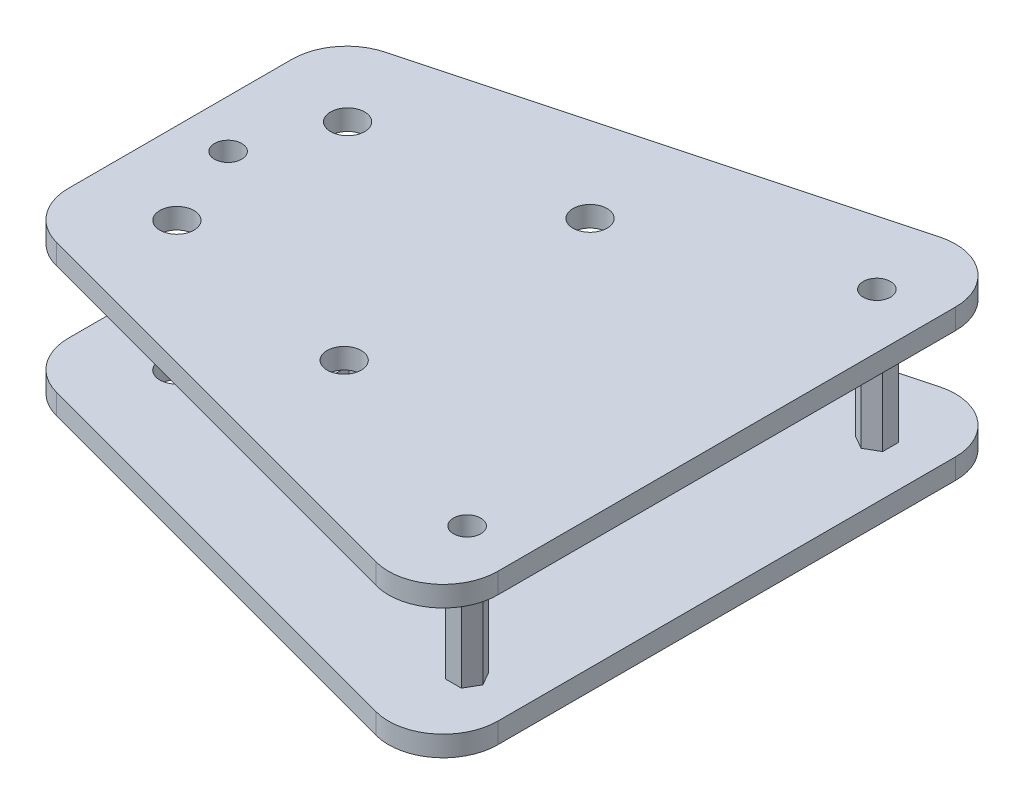
from build123d import *

# Parameters (mm, degrees)
CROQUIS1_R                = 2.5
CROQUIS1_R_2              = 2
SALIENTE_EXTRUIR1_DEPTH   = 22
CROQUIS2_W                = 80
CROQUIS2_H                = 16
CORTAR_EXTRUIR1_DEPTH     = 50
SALIENTE_EXTRUIR2_DEPTH   = 16
SALIENTE_EXTRUIR2_2_DEPTH = 16
SALIENTE_EXTRUIR2_3_DEPTH = 16
CUT_EXTRUDE1_DEPTH        = 11


with BuildPart() as part:
    # Croquis1 → Saliente-Extruir1 (new body)
    with BuildSketch(Plane(origin=(0, 0, 0), x_dir=(1, 0, 0), z_dir=(0, 1, 0))):
        with BuildLine():
            Line((0, 16.361384096), (0, -16.361384096))
            ThreePointArc((0, -16.361384096), (1.653173278, -21.231475528), (5.929447639, -24.088790706))
            Line((5.929447639, -24.088790706), (69.929447639, -41.237539022))
            ThreePointArc((69.929447639, -41.237539022), (76.870091432, -39.856959134), (80, -33.510132412))
            Line((80, -33.510132412), (80, 33.510132412))
            ThreePointArc((80, 33.510132412), (76.870091432, 39.856959134), (69.929447639, 41.237539022))
            Line((69.929447639, 41.237539022), (5.929447639, 24.088790706))
            ThreePointArc((5.929447639, 24.088790706), (1.653173278, 21.231475528), (0, 16.361384096))
        make_face()
        with Locations(Location((12, 12.5, 0), (0, 0, 270))):
            Circle(CROQUIS1_R, mode=Mode.SUBTRACT)
        with Locations(Location((12, -12.5, 0), (0, 0, 270))):
            Circle(CROQUIS1_R, mode=Mode.SUBTRACT)
        with Locations(Location((42, 18, 0), (0, 0, 270))):
            Circle(CROQUIS1_R, mode=Mode.SUBTRACT)
        with Locations(Location((42, -18, 0), (0, 0, 270))):
            Circle(CROQUIS1_R, mode=Mode.SUBTRACT)
        with Locations(Location((7, 0, 0), (0, 0, 270))):
            Circle(CROQUIS1_R_2, mode=Mode.SUBTRACT)
        with Locations(Location((72, -30, 0), (0, 0, 270))):
            Circle(CROQUIS1_R_2, mode=Mode.SUBTRACT)
        with Locations(Location((72, 30, 0), (0, 0, 270))):
            Circle(CROQUIS1_R_2, mode=Mode.SUBTRACT)
    extrude(amount=SALIENTE_EXTRUIR1_DEPTH)

    # Croquis2 → Cortar-Extruir1 (cut, symmetric)
    with BuildSketch(Plane.XY):
        with Locations((40, 11)):
            Rectangle(CROQUIS2_W, CROQUIS2_H)
    extrude(amount=CORTAR_EXTRUIR1_DEPTH, both=True, mode=Mode.SUBTRACT)


with BuildPart() as cortar_extruir1_piece_1:
    # of the separate pieces the step leaves, piece 1, a body of its own (cortar_extruir1_pieces)
    add(part.part.solids().sort_by_distance((69.929447639, 0, -41.237539022))[0])

    # Sketch1 → Cut-Extrude1 (cut)
    # profile 1 of 7: a face of its own
    with BuildSketch(Plane(origin=(0, 0, 0), x_dir=(-1, 0, 0), z_dir=(0, -1, 0))):
        with BuildLine():
            Line((-60.773891073, 3.225698816), (-57.023891073, 3.225698816))
            Line((-57.023891073, 3.225698816), (-57.023891073, 2.744929585))
            Line((-57.023891073, 2.744929585), (-57.524191554, 2.744929585))
            add(Edge.make_bspline(
                [(-57.524191554, 2.744929585), (-57.565268647, 2.744001604), (-57.640621666, 2.742299287), (-57.744355067, 2.731956929), (-57.827880549, 2.70965445), (-57.893239168, 2.680273801), (-57.940778851, 2.642177532), (-57.975266029, 2.59954546), (-57.995941385, 2.549820501), (-57.997941334, 2.5147441), (-57.998951169, 2.497032951)],
                knots=[0, 0, 0, 0, 1.649978988, 3.026769637, 4.173115814, 5.108527378, 5.881060813, 6.597094959, 7.291630266, 8, 8, 8, 8], degree=3))
            add(Edge.make_bspline(
                [(-57.998951169, 2.497032951), (-57.997532175, 2.475422139), (-57.994527122, 2.429656185), (-57.977418183, 2.35920865), (-57.947884084, 2.284341099), (-57.921377291, 2.234847908), (-57.907304534, 2.208571412)],
                knots=[0, 0, 0, 0, 0.848893184, 1.797730134, 2.830789942, 4, 4, 4, 4], degree=3))
            Line((-57.907304534, 2.208571412), (-56.256162707, -0.570875703))
            Line((-56.256162707, -0.570875703), (-55.144383861, 1.691744489))
            add(Edge.make_bspline(
                [(-55.144383861, 1.691744489), (-55.123521204, 1.736974213), (-55.083610356, 1.82349994), (-55.039258675, 1.953557341), (-55.012229905, 2.077748632), (-55.008138688, 2.158873031), (-55.006162707, 2.198054585)],
                knots=[0, 0, 0, 0, 1.129148263, 2.160092213, 3.111359234, 4, 4, 4, 4], degree=3))
            add(Edge.make_bspline(
                [(-55.006162707, 2.198054585), (-55.008148023, 2.238443497), (-55.011992072, 2.316646161), (-55.05135179, 2.427058008), (-55.11661168, 2.522497226), (-55.206280573, 2.603307958), (-55.320492044, 2.669103789), (-55.460566749, 2.714193315), (-55.625652801, 2.740700372), (-55.743731872, 2.743454955), (-55.806943957, 2.744929585)],
                knots=[0, 0, 0, 0, 0.884200254, 1.7120247, 2.535601234, 3.399669589, 4.34091696, 5.408595814, 6.612725681, 8, 8, 8, 8], degree=3))
            Line((-55.806943957, 2.744929585), (-56.062352611, 2.744929585))
            Line((-56.062352611, 2.744929585), (-56.062352611, 3.225698816))
            Line((-56.062352611, 3.225698816), (-53.177737227, 3.225698816))
            Line((-53.177737227, 3.225698816), (-53.177737227, 2.744929585))
            add(Edge.make_bspline(
                [(-53.177737227, 2.744929585), (-53.257068608, 2.741372351), (-53.40821543, 2.734594898), (-53.622370649, 2.694285009), (-53.813865219, 2.636459034), (-53.9824556, 2.549956249), (-54.131071522, 2.436942797), (-54.266839958, 2.29739683), (-54.389716465, 2.128376148), (-54.458280114, 2.00113295), (-54.493842996, 1.935133912)],
                knots=[0, 0, 0, 0, 1.158631572, 2.207493144, 3.17456629, 4.071024185, 4.959115416, 5.890271789, 6.905717302, 8, 8, 8, 8], degree=3))
            Line((-54.493842996, 1.935133912), (-56.062352611, -1.032113684))
            Line((-56.062352611, -1.032113684), (-56.062352611, -3.383375703))
            add(Edge.make_bspline(
                [(-56.062352611, -3.383375703), (-56.061038261, -3.416066856), (-56.058579684, -3.477217763), (-56.037055659, -3.563177553), (-56.001536672, -3.63621342), (-55.94993174, -3.696054134), (-55.881848542, -3.741041513), (-55.797953459, -3.771220632), (-55.698697104, -3.791247038), (-55.62727091, -3.792736092), (-55.5890954, -3.793531953)],
                knots=[0, 0, 0, 0, 1.088641102, 2.036373277, 2.932535239, 3.772977452, 4.639074189, 5.622189685, 6.729120018, 8, 8, 8, 8], degree=3))
            Line((-55.5890954, -3.793531953), (-54.812352611, -3.793531953))
            Line((-54.812352611, -3.793531953), (-54.812352611, -4.274301184))
            Line((-54.812352611, -4.274301184), (-58.85081415, -4.274301184))
            Line((-58.85081415, -4.274301184), (-58.85081415, -3.793531953))
            Line((-58.85081415, -3.793531953), (-58.078578573, -3.793531953))
            add(Edge.make_bspline(
                [(-58.078578573, -3.793531953), (-58.037969675, -3.792467689), (-57.962291503, -3.790484341), (-57.857770647, -3.77413497), (-57.7732193, -3.742384569), (-57.705176728, -3.699580135), (-57.657432145, -3.639050817), (-57.62437071, -3.565809993), (-57.602853298, -3.479227667), (-57.601520305, -3.416569164), (-57.60081415, -3.383375703)],
                knots=[0, 0, 0, 0, 1.33431287, 2.486606761, 3.455237023, 4.285744345, 5.09261012, 5.946421484, 6.912112891, 8, 8, 8, 8], degree=3))
            Line((-57.60081415, -3.383375703), (-57.60081415, -1.293531953))
            Line((-57.60081415, -1.293531953), (-59.657605015, 2.168006508))
            add(Edge.make_bspline(
                [(-59.657605015, 2.168006508), (-59.688999915, 2.219874353), (-59.748649641, 2.318422293), (-59.851040792, 2.446137845), (-59.954646645, 2.549436821), (-60.064994796, 2.626569597), (-60.184672816, 2.678808855), (-60.313871258, 2.71915544), (-60.457661124, 2.74086375), (-60.557980287, 2.743538943), (-60.610129054, 2.744929585)],
                knots=[0, 0, 0, 0, 1.231026377, 2.338927208, 3.317810476, 4.195831411, 5.056695332, 5.961387997, 6.940271265, 8, 8, 8, 8], degree=3))
            Line((-60.610129054, 2.744929585), (-60.773891073, 2.744929585))
            Line((-60.773891073, 2.744929585), (-60.773891073, 3.225698816))
        make_face()
    # profile 2 of 7: a face of its own
    with BuildSketch(Plane(origin=(0, 0, 0), x_dir=(-1, 0, 0), z_dir=(0, -1, 0))):
        with BuildLine():
            Line((-47.253758861, -3.793531953), (-47.023891073, -4.125563203))
            add(Edge.make_bspline(
                [(-47.023891073, -4.125563203), (-47.076209743, -4.155581503), (-47.177095033, -4.21346533), (-47.326447031, -4.289157236), (-47.468932454, -4.34777549), (-47.604453888, -4.395012571), (-47.740278518, -4.425821324), (-47.878457208, -4.450882635), (-48.023735477, -4.464033299), (-48.122626667, -4.465737053), (-48.173230015, -4.466608876)],
                knots=[0, 0, 0, 0, 1.190639995, 2.295892828, 3.301952218, 4.230417227, 5.124784651, 6.047918919, 7.001105777, 8, 8, 8, 8], degree=3))
            add(Edge.make_bspline(
                [(-48.173230015, -4.466608876), (-48.245960339, -4.464235527), (-48.384723869, -4.459707371), (-48.582825528, -4.427493656), (-48.758308673, -4.370093848), (-48.917807633, -4.290641598), (-49.059930501, -4.1740205), (-49.190731816, -4.019562539), (-49.317347612, -3.827342225), (-49.389373061, -3.680788253), (-49.427737227, -3.602726665)],
                knots=[0, 0, 0, 0, 1.066664263, 2.035108476, 2.931696402, 3.766104972, 4.633328674, 5.606912326, 6.725328147, 8, 8, 8, 8], degree=3))
            add(Edge.make_bspline(
                [(-49.427737227, -3.602726665), (-49.508304398, -3.681005182), (-49.66058918, -3.828964041), (-49.892292736, -4.020883661), (-50.110769963, -4.173390766), (-50.321135674, -4.289631377), (-50.534100151, -4.368272059), (-50.753166966, -4.426656646), (-50.986262482, -4.459236734), (-51.145891411, -4.464112578), (-51.227617034, -4.466608876)],
                knots=[0, 0, 0, 0, 1.308593802, 2.473450624, 3.50132852, 4.409978718, 5.265108425, 6.139845439, 7.047651995, 8, 8, 8, 8], degree=3))
            add(Edge.make_bspline(
                [(-51.227617034, -4.466608876), (-51.283769366, -4.466133423), (-51.393332098, -4.465205733), (-51.552112753, -4.446742931), (-51.702373709, -4.424771264), (-51.842060717, -4.387376869), (-51.974215702, -4.343595859), (-52.094971893, -4.285520445), (-52.208446539, -4.221237563), (-52.309761481, -4.14477692), (-52.399515793, -4.05995162), (-52.480417332, -3.971969256), (-52.546967557, -3.876145561), (-52.601072519, -3.774505038), (-52.645373452, -3.668190266), (-52.675090567, -3.555451497), (-52.693643908, -3.438083534), (-52.695849944, -3.35790541), (-52.696967996, -3.317269934)],
                knots=[0, 0, 0, 0, 1.285346722, 2.507929693, 3.658414148, 4.76028252, 5.816036181, 6.842461126, 7.824322881, 8.799459477, 9.741018542, 10.650872844, 11.53244219, 12.405008039, 13.284858853, 14.164260801, 15.069619819, 16, 16, 16, 16], degree=3))
            add(Edge.make_bspline(
                [(-52.696967996, -3.317269934), (-52.694414326, -3.256048008), (-52.689374067, -3.135212345), (-52.656823232, -2.958719189), (-52.598064089, -2.792317431), (-52.518300942, -2.635636596), (-52.415685032, -2.487670721), (-52.290879487, -2.349423936), (-52.141304921, -2.222270539), (-52.03019587, -2.147800268), (-51.972809342, -2.109337242)],
                knots=[0, 0, 0, 0, 0.995801517, 1.96544511, 2.905633422, 3.856346558, 4.816537031, 5.825738476, 6.877019287, 8, 8, 8, 8], degree=3))
            add(Edge.make_bspline(
                [(-51.972809342, -2.109337242), (-51.917752753, -2.07821739), (-51.796234972, -2.009531418), (-51.584113776, -1.922544554), (-51.330573982, -1.831987211), (-51.033253451, -1.743565752), (-50.693277372, -1.652985993), (-50.309856275, -1.566232553), (-49.88394476, -1.474967379), (-49.584632312, -1.419015128), (-49.427737227, -1.389685799)],
                knots=[0, 0, 0, 0, 0.571158686, 1.260629055, 2.068141078, 3.004654038, 4.063103147, 5.24787825, 6.557379157, 8, 8, 8, 8], degree=3))
            Line((-49.427737227, -1.389685799), (-49.427737227, -0.733135319))
            add(Edge.make_bspline(
                [(-49.427737227, -0.733135319), (-49.430292464, -0.670731521), (-49.435234684, -0.550033041), (-49.482794213, -0.378244207), (-49.563242276, -0.225874067), (-49.671857345, -0.093406854), (-49.806186837, 0.016884074), (-49.9661648, 0.093126616), (-50.145562532, 0.141702377), (-50.272252919, 0.146354406), (-50.338193957, 0.148775739)],
                knots=[0, 0, 0, 0, 1.048850548, 2.028637255, 2.971451416, 3.930078998, 4.895246658, 5.871835951, 6.892312576, 8, 8, 8, 8], degree=3))
            add(Edge.make_bspline(
                [(-50.338193957, 0.148775739), (-50.389931654, 0.147227632), (-50.490648185, 0.144213969), (-50.636186491, 0.115424194), (-50.773995185, 0.073684815), (-50.857153212, 0.02854193), (-50.898590592, 0.006047374)],
                knots=[0, 0, 0, 0, 1.060051457, 2.0635767, 3.035086446, 4, 4, 4, 4], degree=3))
            add(Edge.make_bspline(
                [(-50.898590592, 0.006047374), (-50.923324609, -0.008569585), (-50.968269324, -0.035130375), (-51.019845099, -0.083317049), (-51.055130141, -0.131770558), (-51.060042334, -0.166786837), (-51.062352611, -0.183255511)],
                knots=[0, 0, 0, 0, 1.317511825, 2.394079104, 3.244711643, 4, 4, 4, 4], degree=3))
            add(Edge.make_bspline(
                [(-51.062352611, -0.183255511), (-51.058347481, -0.204175816), (-51.048184547, -0.257260642), (-51.018649547, -0.30286129), (-51.000754054, -0.330491088)],
                knots=[0, 0, 0, 0, 0.788183978, 2, 2, 2, 2], degree=3))
            add(Edge.make_bspline(
                [(-51.000754054, -0.330491088), (-50.980654043, -0.367068227), (-50.94152073, -0.438281355), (-50.902068199, -0.550471802), (-50.873770605, -0.660618965), (-50.871271072, -0.734468386), (-50.870044919, -0.770695415)],
                knots=[0, 0, 0, 0, 1.07655196, 2.095971236, 3.065973652, 4, 4, 4, 4], degree=3))
            add(Edge.make_bspline(
                [(-50.870044919, -0.770695415), (-50.872302961, -0.814995261), (-50.876663602, -0.900545363), (-50.912009258, -1.023159682), (-50.973249413, -1.131169463), (-51.056978356, -1.223879847), (-51.160779106, -1.297843269), (-51.281353862, -1.352879808), (-51.418863386, -1.384175746), (-51.515418829, -1.387800034), (-51.5656579, -1.389685799)],
                knots=[0, 0, 0, 0, 1.013390106, 1.957018698, 2.891613793, 3.833568295, 4.79480406, 5.790452495, 6.850343284, 8, 8, 8, 8], degree=3))
            add(Edge.make_bspline(
                [(-51.5656579, -1.389685799), (-51.61947663, -1.38761974), (-51.72292886, -1.38364829), (-51.869090939, -1.346726988), (-51.999557147, -1.28748239), (-52.110311162, -1.203263852), (-52.199722792, -1.100054765), (-52.266750474, -0.98211924), (-52.30426621, -0.848531995), (-52.309610159, -0.755392538), (-52.312352611, -0.707594453)],
                knots=[0, 0, 0, 0, 1.135686363, 2.183055715, 3.163294458, 4.145531186, 5.098416576, 6.031881768, 6.989984632, 8, 8, 8, 8], degree=3))
            add(Edge.make_bspline(
                [(-52.312352611, -0.707594453), (-52.311218457, -0.666875328), (-52.30896864, -0.586100946), (-52.281318516, -0.467591336), (-52.240546562, -0.352701244), (-52.185147473, -0.240071755), (-52.109633886, -0.133687125), (-52.020977516, -0.029219249), (-51.914631513, 0.070390703), (-51.835159078, 0.130950808), (-51.794023284, 0.162297374)],
                knots=[0, 0, 0, 0, 0.92632937, 1.837556265, 2.758171635, 3.702539709, 4.687229428, 5.723494537, 6.821656112, 8, 8, 8, 8], degree=3))
            add(Edge.make_bspline(
                [(-51.794023284, 0.162297374), (-51.739134716, 0.200001777), (-51.628981027, 0.275669249), (-51.45019452, 0.368851913), (-51.263780162, 0.451676075), (-51.065877275, 0.515054392), (-50.859120237, 0.566400604), (-50.642374288, 0.604485753), (-50.415212881, 0.624865214), (-50.260607016, 0.62796686), (-50.181943957, 0.62954497)],
                knots=[0, 0, 0, 0, 0.935767956, 1.877955579, 2.83059031, 3.801741558, 4.795990138, 5.825443329, 6.893591268, 8, 8, 8, 8], degree=3))
            add(Edge.make_bspline(
                [(-50.181943957, 0.62954497), (-50.06411838, 0.626585062), (-49.834701814, 0.620821865), (-49.500641993, 0.578220974), (-49.186188577, 0.508326923), (-48.989362034, 0.435416477), (-48.892881457, 0.399677181)],
                knots=[0, 0, 0, 0, 1.073185449, 2.089584671, 3.063551235, 4, 4, 4, 4], degree=3))
            add(Edge.make_bspline(
                [(-48.892881457, 0.399677181), (-48.834208211, 0.372554199), (-48.717492907, 0.318600015), (-48.560282711, 0.202391163), (-48.42103127, 0.059701117), (-48.30166734, -0.109600754), (-48.200597861, -0.300923655), (-48.131352087, -0.516436757), (-48.088074402, -0.752429352), (-48.083802362, -0.91672648), (-48.081583381, -1.002065607)],
                knots=[0, 0, 0, 0, 0.899251728, 1.788829553, 2.707149947, 3.66811373, 4.667398255, 5.711717518, 6.811421525, 8, 8, 8, 8], degree=3))
            Line((-48.081583381, -1.002065607), (-48.081583381, -3.378868492))
            add(Edge.make_bspline(
                [(-48.081583381, -3.378868492), (-48.080103201, -3.42103513), (-48.077353365, -3.499371104), (-48.058594977, -3.607993755), (-48.025804858, -3.699565572), (-47.989126961, -3.74715284), (-47.9719079, -3.769493492)],
                knots=[0, 0, 0, 0, 1.220920604, 2.268191387, 3.186973035, 4, 4, 4, 4], degree=3))
            add(Edge.make_bspline(
                [(-47.9719079, -3.769493492), (-47.952670447, -3.788082394), (-47.914164923, -3.825289787), (-47.841227922, -3.862409225), (-47.759059964, -3.886173227), (-47.700661424, -3.888474552), (-47.669924727, -3.889685799)],
                knots=[0, 0, 0, 0, 0.954778983, 1.911077644, 2.900544867, 4, 4, 4, 4], degree=3))
            add(Edge.make_bspline(
                [(-47.669924727, -3.889685799), (-47.64130435, -3.8883536), (-47.579576596, -3.885480343), (-47.481619921, -3.865727394), (-47.371270398, -3.835389979), (-47.294653364, -3.80809872), (-47.253758861, -3.793531953)],
                knots=[0, 0, 0, 0, 0.800345766, 1.72616688, 2.78633678, 4, 4, 4, 4], degree=3))
        make_face()
        with BuildLine():
            add(Edge.make_bspline(
                [(-49.427737227, -1.87045503), (-49.508953055, -1.882433337), (-49.664798812, -1.905418615), (-49.888016701, -1.947166196), (-50.090493665, -1.995067488), (-50.272723731, -2.047107577), (-50.434389211, -2.104124875), (-50.575909664, -2.165037226), (-50.697965193, -2.230815824), (-50.799775656, -2.303772912), (-50.885687442, -2.381759906), (-50.958302285, -2.465284152), (-51.02034966, -2.553672014), (-51.070191374, -2.648923902), (-51.111860914, -2.748943069), (-51.137594262, -2.85653092), (-51.155097062, -2.969141152), (-51.157349078, -3.04626399), (-51.158506457, -3.085899742)],
                knots=[0, 0, 0, 0, 1.681975776, 3.227557921, 4.651191003, 5.943682547, 7.108803403, 8.161104256, 9.097960246, 9.943676724, 10.720883199, 11.469943612, 12.207173587, 12.927865325, 13.669083436, 14.420669724, 15.188334545, 16, 16, 16, 16], degree=3))
            add(Edge.make_bspline(
                [(-51.158506457, -3.085899742), (-51.156705584, -3.139646896), (-51.153287093, -3.24167192), (-51.1220683, -3.384972227), (-51.068672116, -3.508683362), (-50.994869803, -3.612924365), (-50.899353171, -3.694023397), (-50.78682726, -3.751980799), (-50.657772238, -3.787189837), (-50.566290448, -3.791355168), (-50.518482419, -3.793531953)],
                knots=[0, 0, 0, 0, 1.189819512, 2.258563569, 3.227487892, 4.157509628, 5.062572389, 5.97576097, 6.942140511, 8, 8, 8, 8], degree=3))
            add(Edge.make_bspline(
                [(-50.518482419, -3.793531953), (-50.479877215, -3.792167899), (-50.404380211, -3.789500331), (-50.293433043, -3.774705846), (-50.187812206, -3.747990839), (-50.088319036, -3.707747873), (-49.992781942, -3.659820913), (-49.901824319, -3.600721045), (-49.816294208, -3.529999451), (-49.737046572, -3.448297954), (-49.662833319, -3.359042415), (-49.599920735, -3.259283975), (-49.547307834, -3.151727227), (-49.503500431, -3.036597655), (-49.468817757, -2.913485181), (-49.445616522, -2.782097569), (-49.429715222, -2.643581399), (-49.42840692, -2.548587625), (-49.427737227, -2.499962242)],
                knots=[0, 0, 0, 0, 0.975091251, 1.906905293, 2.820957317, 3.718054817, 4.611669124, 5.516665246, 6.450964701, 7.407843816, 8.387516827, 9.376855626, 10.377925808, 11.406652237, 12.483683151, 13.602377652, 14.772705824, 16, 16, 16, 16], degree=3))
            Line((-49.427737227, -2.499962242), (-49.427737227, -1.87045503))
        make_face(mode=Mode.SUBTRACT)
    # profile 3 of 7: a face of its own
    with BuildSketch(Plane(origin=(0, 0, 0), x_dir=(-1, 0, 0), z_dir=(0, -1, 0))):
        with BuildLine():
            Line((-43.562352611, 3.225698816), (-41.062352611, 3.418006508))
            Line((-41.062352611, 3.418006508), (-41.062352611, -2.833495896))
            add(Edge.make_bspline(
                [(-41.062352611, -2.833495896), (-41.061508726, -2.906625149), (-41.059964077, -3.040481026), (-41.048902399, -3.221691162), (-41.030526787, -3.364474716), (-41.005108778, -3.473684857), (-40.965591851, -3.555702342), (-40.921011527, -3.623153968), (-40.865440428, -3.677361175), (-40.801008302, -3.725394987), (-40.712670005, -3.756243974), (-40.599750063, -3.779410204), (-40.456108164, -3.791348867), (-40.350724287, -3.792760409), (-40.293121842, -3.793531953)],
                knots=[0, 0, 0, 0, 1.771249853, 3.242097946, 4.393102828, 5.25803248, 5.941698374, 6.587632784, 7.205155312, 7.814282309, 8.517048691, 9.447215625, 10.604657339, 12, 12, 12, 12], degree=3))
            Line((-40.293121842, -3.793531953), (-40.293121842, -4.274301184))
            Line((-40.293121842, -4.274301184), (-42.216198765, -4.334397338))
            Line((-42.216198765, -4.334397338), (-42.408506457, -3.539625703))
            add(Edge.make_bspline(
                [(-42.408506457, -3.539625703), (-42.445258908, -3.584456433), (-42.51642329, -3.671262921), (-42.62471089, -3.793007907), (-42.730265141, -3.903458411), (-42.833385864, -4.002386145), (-42.934014961, -4.0898481), (-43.031652655, -4.165391199), (-43.127020908, -4.229193253), (-43.252044596, -4.300122422), (-43.419404836, -4.369242816), (-43.638377679, -4.425431373), (-43.879266369, -4.46003622), (-44.047507186, -4.464364126), (-44.134768477, -4.466608876)],
                knots=[0, 0, 0, 0, 1.019123134, 1.97334506, 2.863856434, 3.704571555, 4.484833956, 5.206886871, 5.873561384, 6.500440825, 7.731769516, 9.04307432, 10.466334425, 12, 12, 12, 12], degree=3))
            add(Edge.make_bspline(
                [(-44.134768477, -4.466608876), (-44.214483073, -4.464511691), (-44.370985279, -4.460394325), (-44.60010945, -4.430329171), (-44.817785988, -4.378693459), (-45.024767627, -4.30865821), (-45.220079121, -4.215981114), (-45.403883594, -4.103022784), (-45.57593235, -3.969359252), (-45.736875716, -3.818652352), (-45.880622128, -3.648226184), (-46.00816218, -3.463352357), (-46.112625429, -3.261655404), (-46.200752068, -3.047289052), (-46.268264533, -2.817631913), (-46.315097163, -2.573575023), (-46.346870946, -2.31549828), (-46.349477774, -2.138484067), (-46.35081415, -2.047738684)],
                knots=[0, 0, 0, 0, 1.035088772, 2.032170809, 2.994453607, 3.936434391, 4.864481922, 5.795873368, 6.732495421, 7.689444774, 8.653769356, 9.622470292, 10.5999517, 11.597542668, 12.628516414, 13.702472802, 14.822185049, 16, 16, 16, 16], degree=3))
            add(Edge.make_bspline(
                [(-46.35081415, -2.047738684), (-46.348798816, -1.947499161), (-46.34486953, -1.752062687), (-46.314184154, -1.466781455), (-46.265174517, -1.197415098), (-46.196706726, -0.943513385), (-46.105728788, -0.706356894), (-45.996232575, -0.484598804), (-45.866562041, -0.27891786), (-45.717299571, -0.091686037), (-45.555132743, 0.077847824), (-45.379154031, 0.224603047), (-45.194366875, 0.349318972), (-45.000762734, 0.453574197), (-44.795785626, 0.531120372), (-44.58213699, 0.589048156), (-44.358143781, 0.622048968), (-44.20598529, 0.62702131), (-44.128758861, 0.62954497)],
                knots=[0, 0, 0, 0, 1.233427243, 2.404806639, 3.526640168, 4.600198104, 5.636101454, 6.647681776, 7.639427867, 8.622208794, 9.589876305, 10.521849241, 11.43639751, 12.329723671, 13.221368586, 14.127361881, 15.049562369, 16, 16, 16, 16], degree=3))
            add(Edge.make_bspline(
                [(-44.128758861, 0.62954497), (-44.04646924, 0.626472746), (-43.885293611, 0.620455369), (-43.649679808, 0.578618403), (-43.429355237, 0.503841209), (-43.221129889, 0.401800332), (-43.023770815, 0.267441941), (-42.839603168, 0.094879503), (-42.661933846, -0.110663216), (-42.558497693, -0.267097563), (-42.504660304, -0.348519934)],
                knots=[0, 0, 0, 0, 0.992219846, 1.943400107, 2.873411088, 3.788957687, 4.731974812, 5.740634663, 6.824024997, 8, 8, 8, 8], degree=3))
            Line((-42.504660304, -0.348519934), (-42.504660304, 1.873535354))
            add(Edge.make_bspline(
                [(-42.504660304, 1.873535354), (-42.505441539, 1.935151751), (-42.506885603, 2.049045733), (-42.519082254, 2.206002679), (-42.542457272, 2.334388143), (-42.573928921, 2.437674147), (-42.614371894, 2.519403297), (-42.659175845, 2.587367825), (-42.712519237, 2.640634756), (-42.775423897, 2.683593894), (-42.85935306, 2.712423369), (-42.969582687, 2.731722255), (-43.111929207, 2.742547042), (-43.217283228, 2.74408261), (-43.275393477, 2.744929585)],
                knots=[0, 0, 0, 0, 1.585915895, 2.931464457, 4.046338307, 4.93909016, 5.700024691, 6.386459051, 7.024471193, 7.628643659, 8.330161029, 9.288263681, 10.504284204, 12, 12, 12, 12], degree=3))
            Line((-43.275393477, 2.744929585), (-43.562352611, 2.744929585))
            Line((-43.562352611, 2.744929585), (-43.562352611, 3.225698816))
        make_face()
        with BuildLine():
            add(Edge.make_bspline(
                [(-43.657004054, -0.043531953), (-43.706209563, -0.044628474), (-43.802328981, -0.046770449), (-43.941039836, -0.073518018), (-44.07020978, -0.114167608), (-44.190951015, -0.169731686), (-44.300569985, -0.244281006), (-44.401047701, -0.33379469), (-44.490693145, -0.440350418), (-44.540407965, -0.520611784), (-44.565958381, -0.56186128)],
                knots=[0, 0, 0, 0, 1.071115477, 2.092346891, 3.065852581, 4.018074183, 4.97777408, 5.944093316, 6.943388102, 8, 8, 8, 8], degree=3))
            add(Edge.make_bspline(
                [(-44.565958381, -0.56186128), (-44.585692062, -0.599086248), (-44.627130903, -0.677255113), (-44.677468531, -0.806643035), (-44.718917289, -0.951674518), (-44.753251442, -1.111325138), (-44.779931399, -1.286428617), (-44.799543519, -1.476934147), (-44.80914294, -1.683558789), (-44.811255922, -1.82637701), (-44.812352611, -1.900503107)],
                knots=[0, 0, 0, 0, 0.734876037, 1.543169267, 2.417216888, 3.365266492, 4.391295652, 5.50713649, 6.70614379, 8, 8, 8, 8], degree=3))
            add(Edge.make_bspline(
                [(-44.812352611, -1.900503107), (-44.812374512, -1.962113569), (-44.812417086, -2.081880236), (-44.803895716, -2.255160315), (-44.794139064, -2.41654911), (-44.779241881, -2.565933799), (-44.759474789, -2.703123249), (-44.738169121, -2.828937742), (-44.708980642, -2.941475459), (-44.668188532, -3.073411636), (-44.607047323, -3.220297275), (-44.513760566, -3.372965704), (-44.410454791, -3.505759118), (-44.288733871, -3.611268896), (-44.155612333, -3.693439456), (-44.012611384, -3.750482508), (-43.861616622, -3.786722228), (-43.757872428, -3.791235382), (-43.705080977, -3.793531953)],
                knots=[0, 0, 0, 0, 1.19641219, 2.325746232, 3.368717915, 4.336551961, 5.24028932, 6.060675424, 6.813215653, 7.49615923, 8.742683772, 9.890340957, 10.962784833, 11.996737331, 13.000983, 13.987166933, 14.975746264, 16, 16, 16, 16], degree=3))
            add(Edge.make_bspline(
                [(-43.705080977, -3.793531953), (-43.661444127, -3.791896749), (-43.576233236, -3.788703639), (-43.4514365, -3.769296492), (-43.333090757, -3.734704602), (-43.221872316, -3.684066317), (-43.115719379, -3.62283622), (-43.017073846, -3.546276654), (-42.924943063, -3.456239635), (-42.871454281, -3.387066549), (-42.844203573, -3.351825223)],
                knots=[0, 0, 0, 0, 1.040411318, 2.031640116, 3.002527892, 3.96988569, 4.938421576, 5.917496474, 6.939035529, 8, 8, 8, 8], degree=3))
            add(Edge.make_bspline(
                [(-42.844203573, -3.351825223), (-42.809199591, -3.302358132), (-42.739080502, -3.203266908), (-42.650454445, -3.042485228), (-42.575232774, -2.872031307), (-42.513035349, -2.6912594), (-42.467864978, -2.499747521), (-42.432171504, -2.299269033), (-42.413478457, -2.088155263), (-42.410188503, -1.944103791), (-42.408506457, -1.87045503)],
                knots=[0, 0, 0, 0, 0.924882054, 1.852700299, 2.797758513, 3.767620169, 4.767445866, 5.799740364, 6.875079902, 8, 8, 8, 8], degree=3))
            add(Edge.make_bspline(
                [(-42.408506457, -1.87045503), (-42.409521211, -1.802292154), (-42.411494801, -1.669722527), (-42.430839762, -1.47619353), (-42.457430139, -1.292906844), (-42.500865515, -1.121112763), (-42.552184873, -0.958935985), (-42.619317757, -0.808774771), (-42.695580531, -0.667826472), (-42.783986581, -0.539538723), (-42.879846279, -0.424679007), (-42.979020161, -0.322654116), (-43.083072665, -0.236951021), (-43.190038831, -0.164964), (-43.301819438, -0.110294261), (-43.41740798, -0.073388035), (-43.535643026, -0.04717994), (-43.616294536, -0.044755639), (-43.657004054, -0.043531953)],
                knots=[0, 0, 0, 0, 1.335904166, 2.598193131, 3.810499392, 4.963085132, 6.068449562, 7.141148964, 8.18256652, 9.206574162, 10.189658606, 11.11307494, 11.991824036, 12.827845903, 13.635837991, 14.421385665, 15.203181339, 16, 16, 16, 16], degree=3))
        make_face(mode=Mode.SUBTRACT)
    # profile 4 of 7: a face of its own
    with BuildSketch(Plane(origin=(0, 0, 0), x_dir=(-1, 0, 0), z_dir=(0, -1, 0))):
        with BuildLine():
            Line((-39.523891073, 3.225698816), (-37.312352611, 3.418006508))
            Line((-37.312352611, 3.418006508), (-37.312352611, -1.888483876))
            Line((-37.312352611, -1.888483876), (-35.919624246, -0.755671376))
            add(Edge.make_bspline(
                [(-35.919624246, -0.755671376), (-35.869755849, -0.713324319), (-35.779743701, -0.636888142), (-35.675933693, -0.518338568), (-35.604397714, -0.41351809), (-35.592712593, -0.342204453), (-35.587592996, -0.310959838)],
                knots=[0, 0, 0, 0, 1.378693414, 2.488533117, 3.337781633, 4, 4, 4, 4], degree=3))
            add(Edge.make_bspline(
                [(-35.587592996, -0.310959838), (-35.58959995, -0.293695579), (-35.593764767, -0.257868909), (-35.620754338, -0.206023009), (-35.669651055, -0.163218356), (-35.731524447, -0.119974607), (-35.813908041, -0.084336776), (-35.917355575, -0.059454683), (-36.04143214, -0.045402497), (-36.131425756, -0.044183618), (-36.179540111, -0.043531953)],
                knots=[0, 0, 0, 0, 0.586562145, 1.217229734, 1.926113921, 2.76961252, 3.773564686, 4.947918537, 6.368229449, 8, 8, 8, 8], degree=3))
            Line((-36.179540111, -0.043531953), (-36.35081415, -0.043531953))
            Line((-36.35081415, -0.043531953), (-36.35081415, 0.437237277))
            Line((-36.35081415, 0.437237277), (-33.562352611, 0.437237277))
            Line((-33.562352611, 0.437237277), (-33.562352611, -0.043531953))
            add(Edge.make_bspline(
                [(-33.562352611, -0.043531953), (-33.631541664, -0.046037739), (-33.762717705, -0.050788476), (-33.946622536, -0.07270558), (-34.107973201, -0.099024593), (-34.205093844, -0.127765092), (-34.250453573, -0.141188203)],
                knots=[0, 0, 0, 0, 1.19110104, 2.258217353, 3.186508793, 4, 4, 4, 4], degree=3))
            add(Edge.make_bspline(
                [(-34.250453573, -0.141188203), (-34.307033595, -0.162079079), (-34.420600506, -0.204011055), (-34.584127408, -0.28872611), (-34.743322359, -0.389018366), (-34.844007737, -0.466860702), (-34.894984823, -0.506272338)],
                knots=[0, 0, 0, 0, 0.971345689, 1.94967632, 2.961919508, 4, 4, 4, 4], degree=3))
            Line((-34.894984823, -0.506272338), (-35.698770881, -1.161320415))
            Line((-35.698770881, -1.161320415), (-33.942460784, -3.529108876))
            add(Edge.make_bspline(
                [(-33.942460784, -3.529108876), (-33.906458737, -3.569362356), (-33.837663798, -3.646281197), (-33.712122008, -3.73165041), (-33.575360794, -3.784210883), (-33.479668717, -3.790417182), (-33.431643477, -3.793531953)],
                knots=[0, 0, 0, 0, 1.085880666, 2.074967979, 3.03387901, 4, 4, 4, 4], degree=3))
            Line((-33.431643477, -3.793531953), (-33.177737227, -3.793531953))
            Line((-33.177737227, -3.793531953), (-33.177737227, -4.274301184))
            Line((-33.177737227, -4.274301184), (-36.158506457, -4.274301184))
            Line((-36.158506457, -4.274301184), (-36.158506457, -3.793531953))
            Line((-36.158506457, -3.793531953), (-35.88206415, -3.793531953))
            add(Edge.make_bspline(
                [(-35.88206415, -3.793531953), (-35.850998218, -3.792747045), (-35.7943129, -3.791314841), (-35.716439348, -3.786359654), (-35.652868071, -3.775079295), (-35.594331515, -3.75453588), (-35.538237242, -3.727002029), (-35.525134018, -3.687399795), (-35.519984823, -3.671837242)],
                knots=[0, 0, 0, 0, 1.375163053, 2.509229562, 3.457047141, 4.207182103, 5.295473472, 6, 6, 6, 6], degree=3))
            add(Edge.make_bspline(
                [(-35.519984823, -3.671837242), (-35.52285143, -3.654811444), (-35.52967506, -3.614283484), (-35.555873866, -3.582243912), (-35.571066554, -3.563664165)],
                knots=[0, 0, 0, 0, 0.840200059, 2, 2, 2, 2], degree=3))
            Line((-35.571066554, -3.563664165), (-36.727917515, -1.999661761))
            Line((-36.727917515, -1.999661761), (-37.312352611, -2.47592378))
            Line((-37.312352611, -2.47592378), (-37.312352611, -3.39389253))
            add(Edge.make_bspline(
                [(-37.312352611, -3.39389253), (-37.311354636, -3.427515628), (-37.309505112, -3.489828508), (-37.292335339, -3.576466624), (-37.260309601, -3.64691036), (-37.217023545, -3.705005057), (-37.156625064, -3.746249376), (-37.082604882, -3.774540966), (-36.99349473, -3.790367934), (-36.92930449, -3.792423377), (-36.894684342, -3.793531953)],
                knots=[0, 0, 0, 0, 1.201365978, 2.226462719, 3.131555905, 3.947874329, 4.782242627, 5.706252343, 6.762897878, 8, 8, 8, 8], degree=3))
            Line((-36.894684342, -3.793531953), (-36.543121842, -3.793531953))
            Line((-36.543121842, -3.793531953), (-36.543121842, -4.274301184))
            Line((-36.543121842, -4.274301184), (-39.427737227, -4.274301184))
            Line((-39.427737227, -4.274301184), (-39.427737227, -3.793531953))
            Line((-39.427737227, -3.793531953), (-39.1047204, -3.793531953))
            add(Edge.make_bspline(
                [(-39.1047204, -3.793531953), (-39.068563541, -3.792220291), (-39.000450318, -3.789749349), (-38.90515919, -3.768199155), (-38.826507993, -3.727947546), (-38.76159037, -3.674021348), (-38.714277646, -3.601587162), (-38.682127612, -3.513739956), (-38.660527934, -3.410945885), (-38.659206194, -3.336925483), (-38.658506457, -3.297738684)],
                knots=[0, 0, 0, 0, 1.129447167, 2.127681692, 3.023514497, 3.86711445, 4.735179937, 5.691311679, 6.777767975, 8, 8, 8, 8], degree=3))
            Line((-38.658506457, -3.297738684), (-38.658506457, 2.354304585))
            add(Edge.make_bspline(
                [(-38.658506457, 2.354304585), (-38.659922927, 2.384471081), (-38.662606327, 2.44161931), (-38.683323049, 2.522044301), (-38.720635149, 2.590113598), (-38.771005938, 2.646611665), (-38.834631904, 2.691517066), (-38.910786372, 2.722081965), (-38.998485904, 2.74261742), (-39.061016562, 2.744127917), (-39.094203573, 2.744929585)],
                knots=[0, 0, 0, 0, 1.087785527, 2.060730481, 2.966252653, 3.861989026, 4.769311801, 5.74911033, 6.805381193, 8, 8, 8, 8], degree=3))
            Line((-39.094203573, 2.744929585), (-39.523891073, 2.744929585))
            Line((-39.523891073, 2.744929585), (-39.523891073, 3.225698816))
        make_face()
    # profile 5 of 7: a face of its own
    with BuildSketch(Plane(origin=(0, 0, 0), x_dir=(-1, 0, 0), z_dir=(0, -1, 0))):
        with BuildLine():
            Line((-27.061451169, -3.793531953), (-26.831583381, -4.125563203))
            add(Edge.make_bspline(
                [(-26.831583381, -4.125563203), (-26.883902051, -4.155581503), (-26.984787341, -4.21346533), (-27.134139338, -4.289157236), (-27.276624762, -4.34777549), (-27.412146196, -4.395012571), (-27.547970825, -4.425821324), (-27.686149516, -4.450882635), (-27.831427785, -4.464033299), (-27.930318975, -4.465737053), (-27.980922323, -4.466608876)],
                knots=[0, 0, 0, 0, 1.190639995, 2.295892828, 3.301952218, 4.230417227, 5.124784651, 6.047918919, 7.001105777, 8, 8, 8, 8], degree=3))
            add(Edge.make_bspline(
                [(-27.980922323, -4.466608876), (-28.053652647, -4.464235527), (-28.192416176, -4.459707371), (-28.390517835, -4.427493656), (-28.566000981, -4.370093848), (-28.725499941, -4.290641598), (-28.867622808, -4.1740205), (-28.998424124, -4.019562539), (-29.125039919, -3.827342225), (-29.197065368, -3.680788253), (-29.235429534, -3.602726665)],
                knots=[0, 0, 0, 0, 1.066664263, 2.035108476, 2.931696402, 3.766104972, 4.633328674, 5.606912326, 6.725328147, 8, 8, 8, 8], degree=3))
            add(Edge.make_bspline(
                [(-29.235429534, -3.602726665), (-29.315996706, -3.681005182), (-29.468281488, -3.828964041), (-29.699985043, -4.020883661), (-29.91846227, -4.173390766), (-30.128827982, -4.289631377), (-30.341792458, -4.368272059), (-30.560859273, -4.426656646), (-30.79395479, -4.459236734), (-30.953583718, -4.464112578), (-31.035309342, -4.466608876)],
                knots=[0, 0, 0, 0, 1.308593802, 2.473450624, 3.50132852, 4.409978718, 5.265108425, 6.139845439, 7.047651995, 8, 8, 8, 8], degree=3))
            add(Edge.make_bspline(
                [(-31.035309342, -4.466608876), (-31.091461673, -4.466133423), (-31.201024406, -4.465205733), (-31.359805061, -4.446742931), (-31.510066016, -4.424771264), (-31.649753024, -4.387376869), (-31.781908009, -4.343595859), (-31.9026642, -4.285520445), (-32.016138847, -4.221237563), (-32.117453789, -4.14477692), (-32.207208101, -4.05995162), (-32.28810964, -3.971969256), (-32.354659865, -3.876145561), (-32.408764826, -3.774505038), (-32.453065759, -3.668190266), (-32.482782875, -3.555451497), (-32.501336215, -3.438083534), (-32.503542251, -3.35790541), (-32.504660304, -3.317269934)],
                knots=[0, 0, 0, 0, 1.285346722, 2.507929693, 3.658414148, 4.76028252, 5.816036181, 6.842461126, 7.824322881, 8.799459477, 9.741018542, 10.650872844, 11.53244219, 12.405008039, 13.284858853, 14.164260801, 15.069619819, 16, 16, 16, 16], degree=3))
            add(Edge.make_bspline(
                [(-32.504660304, -3.317269934), (-32.502106634, -3.256048008), (-32.497066375, -3.135212345), (-32.464515539, -2.958719189), (-32.405756397, -2.792317431), (-32.325993249, -2.635636596), (-32.22337734, -2.487670721), (-32.098571795, -2.349423936), (-31.948997228, -2.222270539), (-31.837888178, -2.147800268), (-31.78050165, -2.109337242)],
                knots=[0, 0, 0, 0, 0.995801517, 1.96544511, 2.905633422, 3.856346558, 4.816537031, 5.825738476, 6.877019287, 8, 8, 8, 8], degree=3))
            add(Edge.make_bspline(
                [(-31.78050165, -2.109337242), (-31.72544506, -2.07821739), (-31.603927279, -2.009531418), (-31.391806084, -1.922544554), (-31.138266289, -1.831987211), (-30.840945759, -1.743565752), (-30.50096968, -1.652985993), (-30.117548583, -1.566232553), (-29.691637068, -1.474967379), (-29.39232462, -1.419015128), (-29.235429534, -1.389685799)],
                knots=[0, 0, 0, 0, 0.571158686, 1.260629055, 2.068141078, 3.004654038, 4.063103147, 5.24787825, 6.557379157, 8, 8, 8, 8], degree=3))
            Line((-29.235429534, -1.389685799), (-29.235429534, -0.733135319))
            add(Edge.make_bspline(
                [(-29.235429534, -0.733135319), (-29.237984772, -0.670731521), (-29.242926992, -0.550033041), (-29.290486521, -0.378244207), (-29.370934584, -0.225874067), (-29.479549653, -0.093406854), (-29.613879144, 0.016884074), (-29.773857108, 0.093126616), (-29.95325484, 0.141702377), (-30.079945226, 0.146354406), (-30.145886265, 0.148775739)],
                knots=[0, 0, 0, 0, 1.048850548, 2.028637255, 2.971451416, 3.930078998, 4.895246658, 5.871835951, 6.892312576, 8, 8, 8, 8], degree=3))
            add(Edge.make_bspline(
                [(-30.145886265, 0.148775739), (-30.197623962, 0.147227632), (-30.298340492, 0.144213969), (-30.443878798, 0.115424194), (-30.581687492, 0.073684815), (-30.66484552, 0.02854193), (-30.7062829, 0.006047374)],
                knots=[0, 0, 0, 0, 1.060051457, 2.0635767, 3.035086446, 4, 4, 4, 4], degree=3))
            add(Edge.make_bspline(
                [(-30.7062829, 0.006047374), (-30.731016917, -0.008569585), (-30.775961632, -0.035130375), (-30.827537407, -0.083317049), (-30.862822449, -0.131770558), (-30.867734642, -0.166786837), (-30.870044919, -0.183255511)],
                knots=[0, 0, 0, 0, 1.317511825, 2.394079104, 3.244711643, 4, 4, 4, 4], degree=3))
            add(Edge.make_bspline(
                [(-30.870044919, -0.183255511), (-30.866039788, -0.204175816), (-30.855876855, -0.257260642), (-30.826341855, -0.30286129), (-30.808446361, -0.330491088)],
                knots=[0, 0, 0, 0, 0.788183978, 2, 2, 2, 2], degree=3))
            add(Edge.make_bspline(
                [(-30.808446361, -0.330491088), (-30.788346351, -0.367068227), (-30.749213038, -0.438281355), (-30.709760507, -0.550471802), (-30.681462913, -0.660618965), (-30.678963379, -0.734468386), (-30.677737227, -0.770695415)],
                knots=[0, 0, 0, 0, 1.07655196, 2.095971236, 3.065973652, 4, 4, 4, 4], degree=3))
            add(Edge.make_bspline(
                [(-30.677737227, -0.770695415), (-30.679995269, -0.814995261), (-30.68435591, -0.900545363), (-30.719701566, -1.023159682), (-30.780941721, -1.131169463), (-30.864670664, -1.223879847), (-30.968471414, -1.297843269), (-31.08904617, -1.352879808), (-31.226555694, -1.384175746), (-31.323111137, -1.387800034), (-31.373350207, -1.389685799)],
                knots=[0, 0, 0, 0, 1.013390106, 1.957018698, 2.891613793, 3.833568295, 4.79480406, 5.790452495, 6.850343284, 8, 8, 8, 8], degree=3))
            add(Edge.make_bspline(
                [(-31.373350207, -1.389685799), (-31.427168938, -1.38761974), (-31.530621168, -1.38364829), (-31.676783246, -1.346726988), (-31.807249455, -1.28748239), (-31.91800347, -1.203263852), (-32.0074151, -1.100054765), (-32.074442782, -0.98211924), (-32.111958518, -0.848531995), (-32.117302467, -0.755392538), (-32.120044919, -0.707594453)],
                knots=[0, 0, 0, 0, 1.135686363, 2.183055715, 3.163294458, 4.145531186, 5.098416576, 6.031881768, 6.989984632, 8, 8, 8, 8], degree=3))
            add(Edge.make_bspline(
                [(-32.120044919, -0.707594453), (-32.118910765, -0.666875328), (-32.116660948, -0.586100946), (-32.089010823, -0.467591336), (-32.04823887, -0.352701244), (-31.99283978, -0.240071755), (-31.917326193, -0.133687125), (-31.828669824, -0.029219249), (-31.722323821, 0.070390703), (-31.642851386, 0.130950808), (-31.601715592, 0.162297374)],
                knots=[0, 0, 0, 0, 0.92632937, 1.837556265, 2.758171635, 3.702539709, 4.687229428, 5.723494537, 6.821656112, 8, 8, 8, 8], degree=3))
            add(Edge.make_bspline(
                [(-31.601715592, 0.162297374), (-31.546827024, 0.200001777), (-31.436673334, 0.275669249), (-31.257886828, 0.368851913), (-31.071472469, 0.451676075), (-30.873569582, 0.515054392), (-30.666812544, 0.566400604), (-30.450066596, 0.604485753), (-30.222905188, 0.624865214), (-30.068299324, 0.62796686), (-29.989636265, 0.62954497)],
                knots=[0, 0, 0, 0, 0.935767956, 1.877955579, 2.83059031, 3.801741558, 4.795990138, 5.825443329, 6.893591268, 8, 8, 8, 8], degree=3))
            add(Edge.make_bspline(
                [(-29.989636265, 0.62954497), (-29.871810688, 0.626585062), (-29.642394122, 0.620821865), (-29.3083343, 0.578220974), (-28.993880884, 0.508326923), (-28.797054342, 0.435416477), (-28.700573765, 0.399677181)],
                knots=[0, 0, 0, 0, 1.073185449, 2.089584671, 3.063551235, 4, 4, 4, 4], degree=3))
            add(Edge.make_bspline(
                [(-28.700573765, 0.399677181), (-28.641900518, 0.372554199), (-28.525185215, 0.318600015), (-28.367975019, 0.202391163), (-28.228723578, 0.059701117), (-28.109359648, -0.109600754), (-28.008290168, -0.300923655), (-27.939044395, -0.516436757), (-27.89576671, -0.752429352), (-27.891494669, -0.91672648), (-27.889275688, -1.002065607)],
                knots=[0, 0, 0, 0, 0.899251728, 1.788829553, 2.707149947, 3.66811373, 4.667398255, 5.711717518, 6.811421525, 8, 8, 8, 8], degree=3))
            Line((-27.889275688, -1.002065607), (-27.889275688, -3.378868492))
            add(Edge.make_bspline(
                [(-27.889275688, -3.378868492), (-27.887795508, -3.42103513), (-27.885045672, -3.499371104), (-27.866287285, -3.607993755), (-27.833497166, -3.699565572), (-27.796819269, -3.74715284), (-27.779600207, -3.769493492)],
                knots=[0, 0, 0, 0, 1.220920604, 2.268191387, 3.186973035, 4, 4, 4, 4], degree=3))
            add(Edge.make_bspline(
                [(-27.779600207, -3.769493492), (-27.760362755, -3.788082394), (-27.721857231, -3.825289787), (-27.648920229, -3.862409225), (-27.566752272, -3.886173227), (-27.508353732, -3.888474552), (-27.477617034, -3.889685799)],
                knots=[0, 0, 0, 0, 0.954778983, 1.911077644, 2.900544867, 4, 4, 4, 4], degree=3))
            add(Edge.make_bspline(
                [(-27.477617034, -3.889685799), (-27.448996657, -3.8883536), (-27.387268903, -3.885480343), (-27.289312228, -3.865727394), (-27.178962705, -3.835389979), (-27.102345672, -3.80809872), (-27.061451169, -3.793531953)],
                knots=[0, 0, 0, 0, 0.800345766, 1.72616688, 2.78633678, 4, 4, 4, 4], degree=3))
        make_face()
        with BuildLine():
            add(Edge.make_bspline(
                [(-29.235429534, -1.87045503), (-29.316645362, -1.882433337), (-29.47249112, -1.905418615), (-29.695709009, -1.947166196), (-29.898185973, -1.995067488), (-30.080416038, -2.047107577), (-30.242081519, -2.104124875), (-30.383601971, -2.165037226), (-30.5056575, -2.230815824), (-30.607467964, -2.303772912), (-30.69337975, -2.381759906), (-30.765994593, -2.465284152), (-30.828041968, -2.553672014), (-30.877883682, -2.648923902), (-30.919553222, -2.748943069), (-30.945286569, -2.85653092), (-30.96278937, -2.969141152), (-30.965041386, -3.04626399), (-30.966198765, -3.085899742)],
                knots=[0, 0, 0, 0, 1.681975776, 3.227557921, 4.651191003, 5.943682547, 7.108803403, 8.161104256, 9.097960246, 9.943676724, 10.720883199, 11.469943612, 12.207173587, 12.927865325, 13.669083436, 14.420669724, 15.188334545, 16, 16, 16, 16], degree=3))
            add(Edge.make_bspline(
                [(-30.966198765, -3.085899742), (-30.964397892, -3.139646896), (-30.9609794, -3.24167192), (-30.929760608, -3.384972227), (-30.876364424, -3.508683362), (-30.80256211, -3.612924365), (-30.707045479, -3.694023397), (-30.594519568, -3.751980799), (-30.465464546, -3.787189837), (-30.373982756, -3.791355168), (-30.326174727, -3.793531953)],
                knots=[0, 0, 0, 0, 1.189819512, 2.258563569, 3.227487892, 4.157509628, 5.062572389, 5.97576097, 6.942140511, 8, 8, 8, 8], degree=3))
            add(Edge.make_bspline(
                [(-30.326174727, -3.793531953), (-30.287569523, -3.792167899), (-30.212072519, -3.789500331), (-30.101125351, -3.774705846), (-29.995504514, -3.747990839), (-29.896011344, -3.707747873), (-29.80047425, -3.659820913), (-29.709516627, -3.600721045), (-29.623986516, -3.529999451), (-29.54473888, -3.448297954), (-29.470525627, -3.359042415), (-29.407613043, -3.259283975), (-29.355000142, -3.151727227), (-29.311192739, -3.036597655), (-29.276510065, -2.913485181), (-29.25330883, -2.782097569), (-29.237407529, -2.643581399), (-29.236099228, -2.548587625), (-29.235429534, -2.499962242)],
                knots=[0, 0, 0, 0, 0.975091251, 1.906905293, 2.820957317, 3.718054817, 4.611669124, 5.516665246, 6.450964701, 7.407843816, 8.387516827, 9.376855626, 10.377925808, 11.406652237, 12.483683151, 13.602377652, 14.772705824, 16, 16, 16, 16], degree=3))
            Line((-29.235429534, -2.499962242), (-29.235429534, -1.87045503))
        make_face(mode=Mode.SUBTRACT)
    # profile 6 of 7: a face of its own
    with BuildSketch(Plane(origin=(0, 0, 0), x_dir=(-1, 0, 0), z_dir=(0, -1, 0))):
        with BuildLine():
            add(Edge.make_bspline(
                [(-24.713193957, 3.225698816), (-24.662224381, 3.223022697), (-24.562180939, 3.217769992), (-24.419154199, 3.169564769), (-24.286438449, 3.09476659), (-24.170797209, 2.989328757), (-24.0705932, 2.866398247), (-23.999507148, 2.724833352), (-23.95342822, 2.57100767), (-23.949149932, 2.463314754), (-23.946967996, 2.408391124)],
                knots=[0, 0, 0, 0, 0.981152361, 1.925812752, 2.882661545, 3.903034282, 4.92815849, 5.926869906, 6.942698962, 8, 8, 8, 8], degree=3))
            add(Edge.make_bspline(
                [(-23.946967996, 2.408391124), (-23.949158415, 2.353474767), (-23.953453334, 2.245796115), (-23.99941194, 2.091867247), (-24.071126372, 1.950335929), (-24.169753648, 1.825948376), (-24.287032656, 1.722174067), (-24.419076305, 1.647135055), (-24.562201184, 1.599033678), (-24.662231214, 1.593766781), (-24.713193957, 1.591083431)],
                knots=[0, 0, 0, 0, 1.057142633, 2.072819497, 3.071381286, 4.103934802, 5.117770336, 6.074475774, 7.018994636, 8, 8, 8, 8], degree=3))
            add(Edge.make_bspline(
                [(-24.713193957, 1.591083431), (-24.765164222, 1.593721801), (-24.866687576, 1.598875827), (-25.012379054, 1.647321213), (-25.146578053, 1.722836267), (-25.263518253, 1.829078854), (-25.363204113, 1.952834456), (-25.4322746, 2.094928046), (-25.479112916, 2.247186479), (-25.483296079, 2.3539438), (-25.485429534, 2.408391124)],
                knots=[0, 0, 0, 0, 0.996119322, 1.945908437, 2.920161298, 3.93617366, 4.964468808, 5.954570355, 6.956809999, 8, 8, 8, 8], degree=3))
            add(Edge.make_bspline(
                [(-25.485429534, 2.408391124), (-25.483286429, 2.463334916), (-25.479084279, 2.571067364), (-25.432520734, 2.724389094), (-25.363642709, 2.866838812), (-25.262913129, 2.989152282), (-25.147078829, 3.095784911), (-25.011908724, 3.169137935), (-24.866749121, 3.218011591), (-24.765185059, 3.223096056), (-24.713193957, 3.225698816)],
                knots=[0, 0, 0, 0, 1.051918892, 2.062576914, 3.051865936, 4.071771793, 5.086950367, 6.055688469, 7.004698141, 8, 8, 8, 8], degree=3))
        make_face()
    # profile 7 of 7: a face of its own
    with BuildSketch(Plane(origin=(0, 0, 0), x_dir=(-1, 0, 0), z_dir=(0, -1, 0))):
        with BuildLine():
            Line((-26.158506457, 0.437237277), (-24.043121842, 0.62954497))
            Line((-24.043121842, 0.62954497), (-24.043121842, -3.449481473))
            add(Edge.make_bspline(
                [(-24.043121842, -3.449481473), (-24.04147022, -3.475107345), (-24.038277939, -3.524637428), (-24.019706491, -3.595420957), (-23.983287513, -3.65513623), (-23.935831472, -3.707015109), (-23.872096149, -3.745727035), (-23.795789319, -3.774429917), (-23.705209541, -3.790273136), (-23.640537087, -3.792395823), (-23.605922323, -3.793531953)],
                knots=[0, 0, 0, 0, 0.974300172, 1.883142448, 2.743982269, 3.604822091, 4.527872055, 5.54483317, 6.685916268, 8, 8, 8, 8], degree=3))
            Line((-23.605922323, -3.793531953), (-23.273891073, -3.793531953))
            Line((-23.273891073, -3.793531953), (-23.273891073, -4.274301184))
            Line((-23.273891073, -4.274301184), (-26.158506457, -4.274301184))
            Line((-26.158506457, -4.274301184), (-26.158506457, -3.793531953))
            Line((-26.158506457, -3.793531953), (-25.847508861, -3.793531953))
            add(Edge.make_bspline(
                [(-25.847508861, -3.793531953), (-25.808347735, -3.792195925), (-25.735872333, -3.78972334), (-25.635667221, -3.769427891), (-25.553949211, -3.73379321), (-25.488401486, -3.681256256), (-25.443349229, -3.607767027), (-25.410101725, -3.51655251), (-25.391857763, -3.404608741), (-25.390177664, -3.323339764), (-25.389275688, -3.279709838)],
                knots=[0, 0, 0, 0, 1.169189395, 2.163815979, 3.034136335, 3.809838862, 4.631353817, 5.573289828, 6.697200457, 8, 8, 8, 8], degree=3))
            Line((-25.389275688, -3.279709838), (-25.389275688, -0.576885319))
            add(Edge.make_bspline(
                [(-25.389275688, -0.576885319), (-25.39062883, -0.536607587), (-25.393205374, -0.459913949), (-25.422948457, -0.352231159), (-25.469429689, -0.258325141), (-25.53591626, -0.180201868), (-25.617838118, -0.117945463), (-25.715283411, -0.073657831), (-25.826718388, -0.048517422), (-25.905470927, -0.045244215), (-25.946667515, -0.043531953)],
                knots=[0, 0, 0, 0, 1.102330428, 2.098969545, 3.03916789, 3.955776185, 4.887400961, 5.840364569, 6.87026359, 8, 8, 8, 8], degree=3))
            Line((-25.946667515, -0.043531953), (-26.158506457, -0.043531953))
            Line((-26.158506457, -0.043531953), (-26.158506457, 0.437237277))
        make_face()
    extrude(amount=-CUT_EXTRUDE1_DEPTH, mode=Mode.SUBTRACT)


with BuildPart() as cortar_extruir1_piece_2:
    # of the separate pieces the step leaves, piece 2, a body of its own (cortar_extruir1_pieces)
    add(part.part.solids().sort_by_distance((5.929447639, 19, -24.088790706))[0])


with BuildPart() as body_3:
    # Croquis3 → Saliente-Extruir2 (new body)
    with BuildSketch(Plane(origin=(0, 3, 0), x_dir=(1, 0, 0), z_dir=(0, 1, 0))):
        Polygon((7, -2.309401077), (9, -1.154700538), (9, 1.154700538), (7, 2.309401077), (5, 1.154700538), (5, -1.154700538), align=None)
    extrude(amount=SALIENTE_EXTRUIR2_DEPTH)


with BuildPart() as body_4:
    # Croquis3 → Saliente-Extruir2 2 (new body)
    with BuildSketch(Plane(origin=(0, 3, 0), x_dir=(1, 0, 0), z_dir=(0, 1, 0))):
        Polygon((70.845299462, -32), (73.154700538, -32), (74.309401077, -30), (73.154700538, -28), (70.845299462, -28), (69.690598923, -30), align=None)
    extrude(amount=SALIENTE_EXTRUIR2_2_DEPTH)


with BuildPart() as body_5:
    # Croquis3 → Saliente-Extruir2 3 (new body)
    with BuildSketch(Plane(origin=(0, 3, 0), x_dir=(1, 0, 0), z_dir=(0, 1, 0))):
        Polygon((74, 28.845299462), (74, 31.154700538), (72, 32.309401077), (70, 31.154700538), (70, 28.845299462), (72, 27.690598923), align=None)
    extrude(amount=SALIENTE_EXTRUIR2_3_DEPTH)


with BuildPart() as body_6:
    # of the pieces the cut leaves, the one that is kept (cut_extrude1_keep)
    add(cortar_extruir1_piece_1.part.solids().sort_by_distance((69.929447639, 0, -41.237539022))[0])


solid = Compound([cortar_extruir1_piece_2.part, body_3.part, body_4.part, body_5.part, body_6.part])
